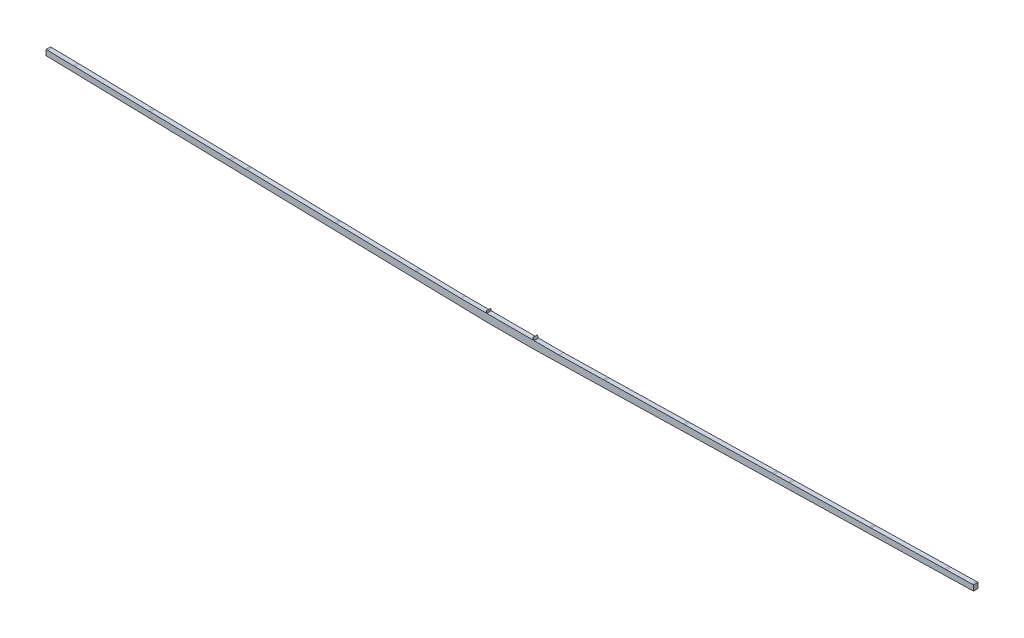
from build123d import *

# Parameters (mm, degrees)
EXTRUDE_1_DEPTH = 5


with BuildPart() as part:
    # Model → 凸台-拉伸1 (new body)
    with BuildSketch(Plane.XY):
        with BuildLine():
            Line((43.845523177, -177.492582663), (538.81027344, -165.856176204))
            Line((538.81027344, -165.856176204), (538.81027344, -159.776195336))
            Line((538.81027344, -159.776195336), (536.81027344, -159.776195336))
            Line((536.81027344, -159.776195336), (508.460943442, -160.297194912))
            Line((508.460943442, -160.297194912), (506.460943442, -160.297194912))
            Line((506.460943442, -160.297194912), (423.796625507, -162.048616282))
            Line((423.796625507, -162.048616282), (421.796625507, -162.048616282))
            Line((421.796625507, -162.048616282), (332.810549536, -163.795959439))
            Line((332.810549536, -163.795959439), (330.810549536, -163.795959439))
            Line((330.810549536, -163.795959439), (314.810549536, -164.194907743))
            Line((314.810549536, -164.194907743), (312.810549536, -164.194907743))
            Line((312.810549536, -164.194907743), (214.560628282, -166.204763766))
            Line((214.560628282, -166.204763766), (212.591381202, -166.204763766))
            ThreePointArc((212.591381202, -166.204763766), (212.560629898, -166.204921378), (212.529881824, -166.205394195))
            Line((212.529881824, -166.205394195), (124.560628282, -168.009124705))
            Line((124.560628282, -168.009124705), (122.560628282, -168.009124705))
            Line((122.560628282, -168.009124705), (72.913804388, -168.993411369))
            Line((72.913804388, -168.993411369), (45.043435184, -168.993411369))
            Line((45.043435184, -168.993411369), (43.780250092, -166.49051255))
            Line((43.780250092, -166.49051255), (43.775013962, -168.993411369))
            Line((43.775013962, -168.993411369), (17.81027344, -168.993411369))
            Line((17.81027344, -168.993411369), (-8.154467083, -168.993411369))
            Line((-8.154467083, -168.993411369), (-8.159703213, -166.49051255))
            Line((-8.159703213, -166.49051255), (-9.422888304, -168.993411369))
            Line((-9.422888304, -168.993411369), (-37.293257509, -168.993411369))
            Line((-37.293257509, -168.993411369), (-86.940081403, -168.009124705))
            Line((-86.940081403, -168.009124705), (-88.940081403, -168.009124705))
            Line((-88.940081403, -168.009124705), (-176.909334945, -166.205394195))
            ThreePointArc((-176.909334945, -166.205394195), (-176.940083018, -166.204921378), (-176.970834323, -166.204763766))
            Line((-176.970834323, -166.204763766), (-178.940081403, -166.204763766))
            Line((-178.940081403, -166.204763766), (-277.190002657, -164.194907743))
            Line((-277.190002657, -164.194907743), (-279.190002657, -164.194907743))
            Line((-279.190002657, -164.194907743), (-295.190002657, -163.795959439))
            Line((-295.190002657, -163.795959439), (-297.190002657, -163.795959439))
            Line((-297.190002657, -163.795959439), (-386.176078628, -162.048616282))
            Line((-386.176078628, -162.048616282), (-388.176078628, -162.048616282))
            Line((-388.176078628, -162.048616282), (-470.840396563, -160.297194912))
            Line((-470.840396563, -160.297194912), (-472.840396563, -160.297194912))
            Line((-472.840396563, -160.297194912), (-501.18972656, -159.776195336))
            Line((-501.18972656, -159.776195336), (-503.18972656, -159.776195336))
            Line((-503.18972656, -159.776195336), (-503.18972656, -165.856176204))
            Line((-503.18972656, -165.856176204), (-8.224976298, -177.492582663))
            ThreePointArc((-8.224976298, -177.492582663), (-8.189724125, -177.493204186), (-8.154467083, -177.493411369))
            Line((-8.154467083, -177.493411369), (17.81027344, -177.493411369))
            Line((17.81027344, -177.493411369), (43.775013962, -177.493411369))
            ThreePointArc((43.775013962, -177.493411369), (43.810271005, -177.493204186), (43.845523177, -177.492582663))
        make_face()
    extrude(amount=EXTRUDE_1_DEPTH)


solid = part.part
